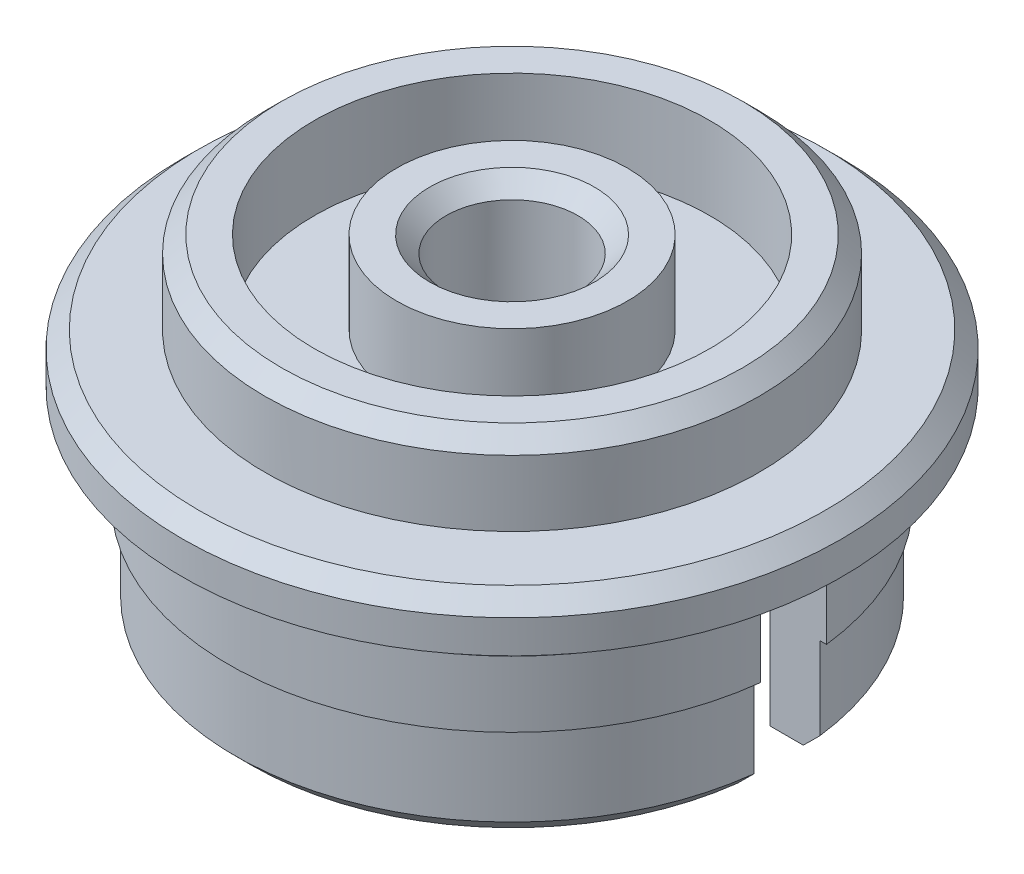
from build123d import *

# Parameters (mm, degrees)
SKETCH_2_R          = 6
SKETCH_2_R_2        = 3.5
CUT_EXTRUDE_1_DEPTH = 2.5
SKETCH_3_R          = 6.9
SKETCH_3_R_2        = 5
CUT_EXTRUDE_2_DEPTH = 6
CUT_EXTRUDE_START   = -6
SKETCH_4_R          = 3.5
CUT_EXTRUDE_3_DEPTH = 6
CUT_EXTRUDE_4_REACH = 19.321
SKETCH_5_R          = 2
CUT_EXTRUDE_5_DEPTH = 6
CHAMFER_1_SIZE      = 0.5


with BuildPart() as part:
    # 草图1 → 旋转1 (revolve)
    with BuildSketch(Plane.XY, mode=Mode.PRIVATE) as revolve_1_sk:
        Polygon((0, 0), (7.5, 0), (7.5, -2.5), (10, -2.5), (10, -4), (8.4, -4), (8.4, -5), (8.6, -5), (8.6, -7), (8.4, -7), (8.4, -10), (0, -10), align=None)
    revolve(revolve_1_sk.sketch.rotate(Axis((0, -10, 0), (0, 1, 0)), 90), axis=Axis((0, -10, 0), (0, 1, 0)))

    # 草图2 → 切除-拉伸1 (cut)
    with BuildSketch(Plane(origin=(0, 0, 0), x_dir=(1, 0, 0), z_dir=(0, 1, 0))):
        with Locations(Location((0, 0, 0), (0, 0, 270))):
            Circle(SKETCH_2_R)
        with Locations(Location((0, 0, 0), (0, 0, 270))):
            Circle(SKETCH_2_R_2, mode=Mode.SUBTRACT)
    extrude(amount=-CUT_EXTRUDE_1_DEPTH, mode=Mode.SUBTRACT)

    # 草图3 → 切除-拉伸2 (cut)
    with BuildSketch(Plane.XZ.offset(10)):
        with Locations(Location((0, 0, 0), (0, 0, 270))):
            Circle(SKETCH_3_R)
        with Locations(Location((0, 0, 0), (0, 0, 270))):
            Circle(SKETCH_3_R_2, mode=Mode.SUBTRACT)
    extrude(amount=-CUT_EXTRUDE_2_DEPTH, mode=Mode.SUBTRACT)

    # 草图4 → 切除-拉伸3 (cut)
    with BuildSketch(Plane.XZ.offset(10).offset(CUT_EXTRUDE_START)):
        with Locations(Location((0, 0, 0), (0, 0, 90))):
            Circle(SKETCH_4_R)
    extrude(amount=CUT_EXTRUDE_3_DEPTH, mode=Mode.SUBTRACT)

    # 草图5 → 切除-拉伸4 (cut, up to next)
    with BuildSketch(Plane(origin=(0, 0, 0), x_dir=(1, 0, 0), z_dir=(0, 1, 0)), mode=Mode.PRIVATE) as cut_extrude_4_sk1:
        with Locations(Location((0, 0, 0), (0, 0, 270))):
            Circle(SKETCH_5_R)
    cut_extrude_4_tool1 = extrude(cut_extrude_4_sk1.sketch, amount=-CUT_EXTRUDE_4_REACH, mode=Mode.PRIVATE) & part.part
    add(cut_extrude_4_tool1.solids().sort_by_distance((0, 0, 0))[0], mode=Mode.SUBTRACT)

    # 草图6 → 切除-拉伸5 (cut)
    with BuildSketch(Plane.XZ.offset(10).offset(CUT_EXTRUDE_START)):
        with BuildLine():
            Line((-8.94427191, -1), (-5.916079783, -1))
            ThreePointArc((-5.916079783, -1), (-6, 0), (-5.916079783, 1))
            Line((-5.916079783, 1), (-8.94427191, 1))
            ThreePointArc((-8.94427191, 1), (-9, 0), (-8.94427191, -1))
        make_face()
        with BuildLine():
            Line((5.916079783, 1), (8.94427191, 1))
            ThreePointArc((8.94427191, 1), (9, 0), (8.94427191, -1))
            Line((8.94427191, -1), (5.916079783, -1))
            ThreePointArc((5.916079783, -1), (6, 0), (5.916079783, 1))
        make_face()
    extrude(amount=CUT_EXTRUDE_5_DEPTH, mode=Mode.SUBTRACT)

    # 倒角1
    chamfer_1_edges = [part.edges().sort_by_distance(p)[0] for p in [
        (0, -2.5, 10),
        (0, 0, 7.5),
        (0, 0, -2),
        (0, -10, -8.4),
        (0, -10, 8.4),
    ]]
    chamfer(chamfer_1_edges, length=CHAMFER_1_SIZE)


solid = part.part
